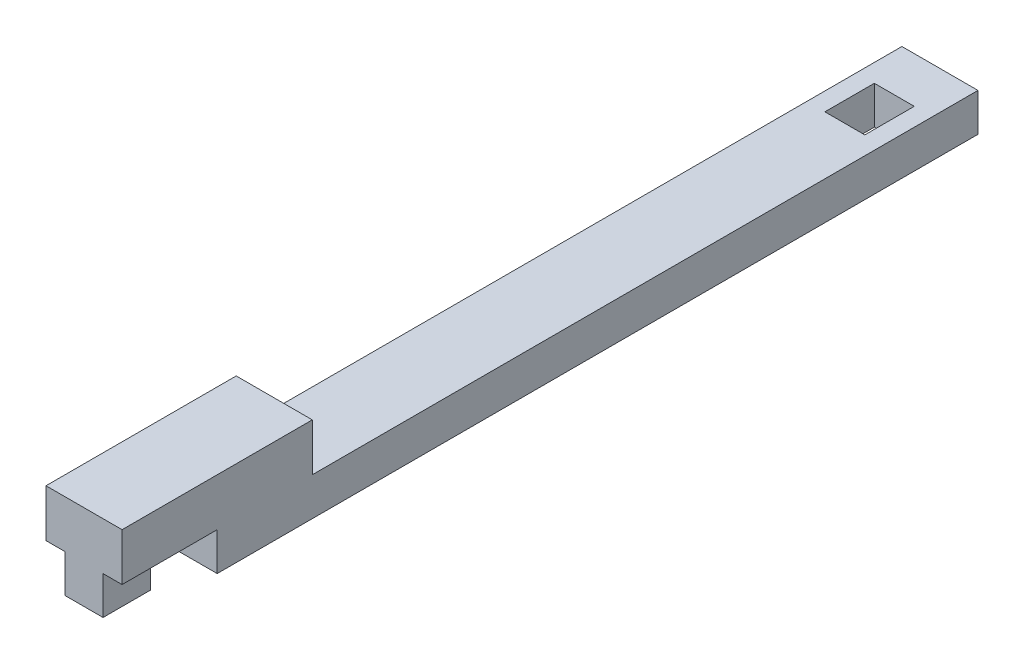
from build123d import *

# Parameters (mm, degrees)
SKETCH_1_W          = 16
SKETCH_1_H          = 160
EXTRUDE_1_DEPTH     = 8
SKETCH_2_W          = 16
SKETCH_2_H          = 20
EXTRUDE_2_DEPTH     = 10
SKETCH_3_W          = 16
SKETCH_3_H          = 10
EXTRUDE_3_DEPTH     = 20
SKETCH_4_W          = 8
SKETCH_4_H          = 10
EXTRUDE_4_DEPTH     = 8
SKETCH_5_W          = 8.4
SKETCH_5_H          = 10.4
CUT_EXTRUDE_1_DEPTH = 162.108658985


with BuildPart() as part:
    # 草图1 → 凸台-拉伸1 (new body)
    with BuildSketch(Plane(origin=(0, 0, 0), x_dir=(1, 0, 0), z_dir=(0, 1, 0))):
        with Locations((8, 80)):
            Rectangle(SKETCH_1_W, SKETCH_1_H)
    extrude(amount=EXTRUDE_1_DEPTH)

    # 草图2 → 凸台-拉伸2 (add)
    with BuildSketch(Plane(origin=(0, 8, 0), x_dir=(1, 0, 0), z_dir=(0, 1, 0))):
        with Locations((8, 10)):
            Rectangle(SKETCH_2_W, SKETCH_2_H)
    extrude(amount=EXTRUDE_2_DEPTH)

    # 草图3 → 凸台-拉伸3 (add)
    with BuildSketch(Plane.XY):
        with Locations((8, 13)):
            Rectangle(SKETCH_3_W, SKETCH_3_H)
    extrude(amount=EXTRUDE_3_DEPTH)

    # 草图4 → 凸台-拉伸4 (add)
    with BuildSketch(Plane.XZ.offset(-8)):
        with Locations((8, 15)):
            Rectangle(SKETCH_4_W, SKETCH_4_H)
    extrude(amount=EXTRUDE_4_DEPTH)

    # 草图5 → 切除-拉伸1 (cut, through all)
    with BuildSketch(Plane(origin=(0, 8, 0), x_dir=(1, 0, 0), z_dir=(0, 1, 0))):
        with Locations((8, 145.2)):
            Rectangle(SKETCH_5_W, SKETCH_5_H)
    extrude(amount=-CUT_EXTRUDE_1_DEPTH, mode=Mode.SUBTRACT)


solid = part.part
